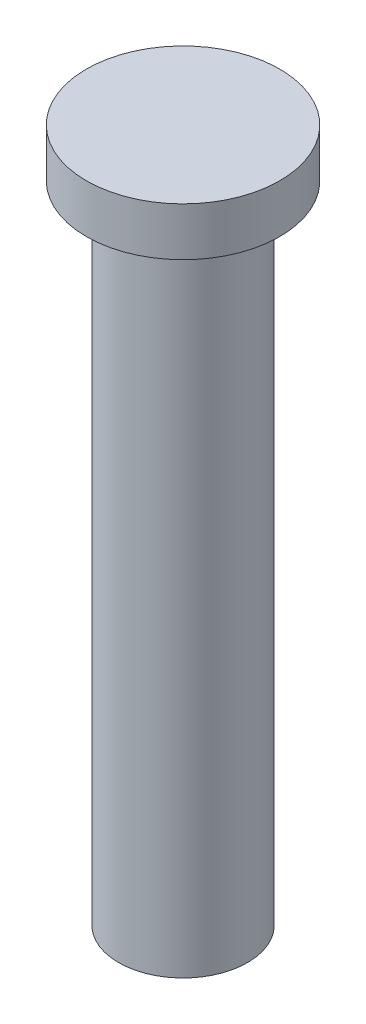
from build123d import *

# Parameters (mm, degrees)
SKETCH_1_R      = 2
EXTRUDE_1_DEPTH = 20
SKETCH_2_R      = 3
EXTRUDE_2_DEPTH = 1.5


with BuildPart() as part:
    # 草图1 → 凸台-拉伸1 (new body)
    with BuildSketch(Plane(origin=(0, 0, 0), x_dir=(1, 0, 0), z_dir=(0, 1, 0))):
        with Locations(Location((0, 0, 0), (0, 0, 270))):
            Circle(SKETCH_1_R)
    extrude(amount=EXTRUDE_1_DEPTH)

    # 草图2 → 凸台-拉伸2 (add)
    with BuildSketch(Plane(origin=(0, 20, 0), x_dir=(1, 0, 0), z_dir=(0, 1, 0))):
        with Locations(Location((0, 0, 0), (0, 0, 270))):
            Circle(SKETCH_2_R)
    extrude(amount=EXTRUDE_2_DEPTH)


solid = part.part
